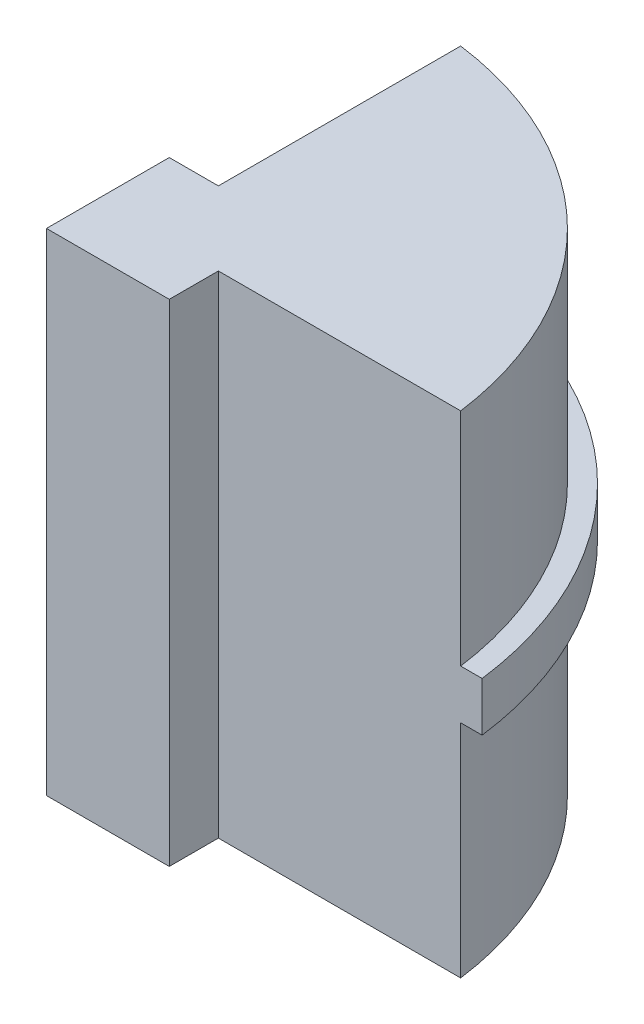
from build123d import *

# Parameters (mm, degrees)
BOSS_EXTRUDE1_DEPTH = 100
BOSS_EXTRUDE2_DEPTH = 5


with BuildPart() as part:
    # Sketch2 → Boss-Extrude1 (new body)
    with BuildSketch(Plane(origin=(0, 0, 0), x_dir=(1, 0, 0), z_dir=(0, 1, 0))):
        with BuildLine():
            Line((-78.383022578, -48.650161377), (-78.383022578, -23.650161377))
            Line((-78.383022578, -23.650161377), (-68.383022578, -23.650161377))
            Line((-68.383022578, -23.650161377), (-68.383022578, 25.68018236))
            ThreePointArc((-68.383022578, 25.68018236), (-25.350013989, 4.382847212), (-4.052678842, -38.650161377))
            Line((-4.052678842, -38.650161377), (-53.383022578, -38.650161377))
            Line((-53.383022578, -38.650161377), (-53.383022578, -48.650161377))
            Line((-53.383022578, -48.650161377), (-78.383022578, -48.650161377))
        make_face()
    extrude(amount=BOSS_EXTRUDE1_DEPTH)

    # Sketch3 → Boss-Extrude2 (add, symmetric)
    with BuildSketch(Plane(origin=(0, 50, 0), x_dir=(-1, 0, 0), z_dir=(0, -1, 0))):
        with BuildLine():
            Line((68.383022578, 25.68018236), (68.383022578, 30.04988769))
            ThreePointArc((68.383022578, 30.04988769), (22.286241373, 7.446619828), (-0.317026488, -38.650161377))
            Line((-0.317026488, -38.650161377), (4.052678842, -38.650161377))
            ThreePointArc((4.052678842, -38.650161377), (25.350013989, 4.382847212), (68.383022578, 25.68018236))
        make_face()
    extrude(amount=BOSS_EXTRUDE2_DEPTH, both=True)


solid = part.part
